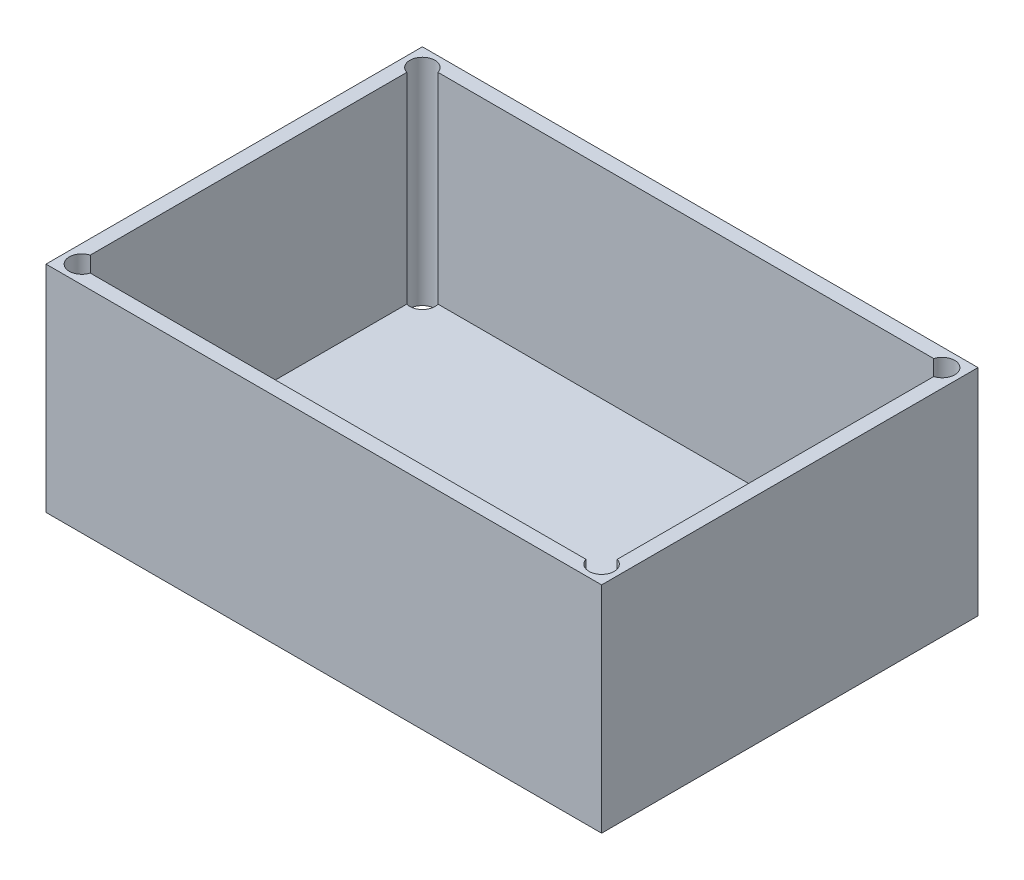
from build123d import *

# Parameters (mm, degrees)
CROQUIS1_W              = 77.5
CROQUIS1_H              = 52.5
SALIENTE_EXTRUIR1_DEPTH = 30
VACIADO1_T              = -2
CROQUIS2_R              = 1.75
CORTAR_EXTRUIR1_DEPTH   = 30


with BuildPart() as part:
    # Croquis1 → Saliente-Extruir1 (new body)
    with BuildSketch(Plane(origin=(0, 0, 0), x_dir=(1, 0, 0), z_dir=(0, 1, 0))):
        Rectangle(CROQUIS1_W, CROQUIS1_H)
    extrude(amount=SALIENTE_EXTRUIR1_DEPTH)

    # Vaciado1
    vaciado1_openings = [part.faces().sort_by_distance(p)[0] for p in [
        (0, 30, 0),
    ]]
    offset(amount=VACIADO1_T, openings=vaciado1_openings, kind=Kind.INTERSECTION)

    # Croquis2 → Cortar-Extruir1 (cut, symmetric)
    with BuildSketch(Plane(origin=(0, 2, 0), x_dir=(1, 0, 0), z_dir=(0, 1, 0))):
        with Locations(Location((-36.25, 23.75, 0), (0, 0, 270))):
            Circle(CROQUIS2_R)
        with Locations(Location((36.25, 23.75, 0), (0, 0, 270))):
            Circle(CROQUIS2_R)
        with Locations(Location((36.25, -23.75, 0), (0, 0, 270))):
            Circle(CROQUIS2_R)
        with Locations(Location((-36.25, -23.75, 0), (0, 0, 270))):
            Circle(CROQUIS2_R)
    extrude(amount=CORTAR_EXTRUIR1_DEPTH, both=True, mode=Mode.SUBTRACT)


solid = part.part
